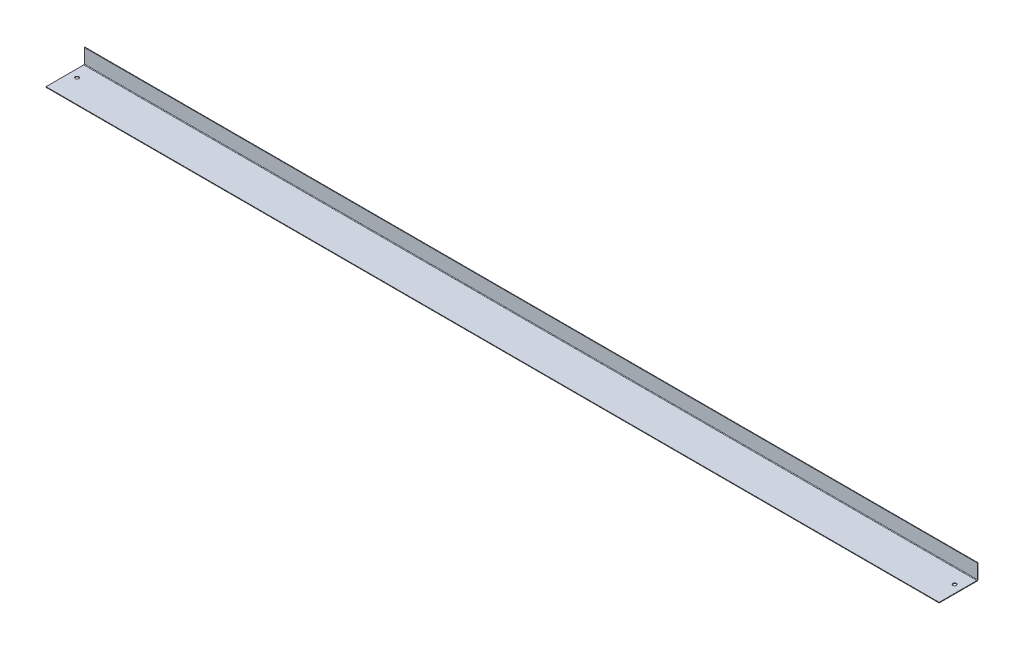
from build123d import *

# Parameters (mm, degrees)
EXTRUDE_THIN1_DEPTH = 1150
FILLET1_R           = 1.5
FILLET2_R           = 3
SKETCH2_R           = 4.5
CUT_EXTRUDE1_DEPTH  = 10


with BuildPart() as part:
    # Sketch1 → Extrude-Thin1 (new, symmetric)
    with BuildSketch(Plane(origin=(0, 0, 0), x_dir=(0, 0, -1), z_dir=(1, 0, 0))):
        Polygon((63.80952381, 24.285714286), (63.80952381, -15.714285714), (-36.19047619, -15.714285714), (-36.19047619, -14.214285714), (62.30952381, -14.214285714), (62.30952381, 24.285714286), align=None)
    extrude(amount=EXTRUDE_THIN1_DEPTH, both=True)

    # Fillet1
    fillet1_edges = [part.edges().sort_by_distance(p)[0] for p in [
        (0, -14.214285714, -62.30952381),
    ]]
    fillet(fillet1_edges, radius=FILLET1_R)

    # Fillet2
    fillet2_edges = [part.edges().sort_by_distance(p)[0] for p in [
        (0, -15.714285714, -63.80952381),
    ]]
    fillet(fillet2_edges, radius=FILLET2_R)

    # Sketch2 → Cut-Extrude1 (cut)
    with BuildSketch(Plane(origin=(0, -14.214285714, 0), x_dir=(1, 0, 0), z_dir=(0, 1, 0))):
        with Locations(Location((-1130, 23.80952381, 0), (0, 0, 270))):
            Circle(SKETCH2_R)
    cut_extrude1 = extrude(amount=-CUT_EXTRUDE1_DEPTH, mode=Mode.SUBTRACT)

    # Mirror1: Cut-Extrude1 across plane
    add(cut_extrude1.mirror(Plane(origin=(0, 0, 0), x_dir=(0, 0, 1), z_dir=(1, 0, 0))), mode=Mode.SUBTRACT)


solid = part.part
